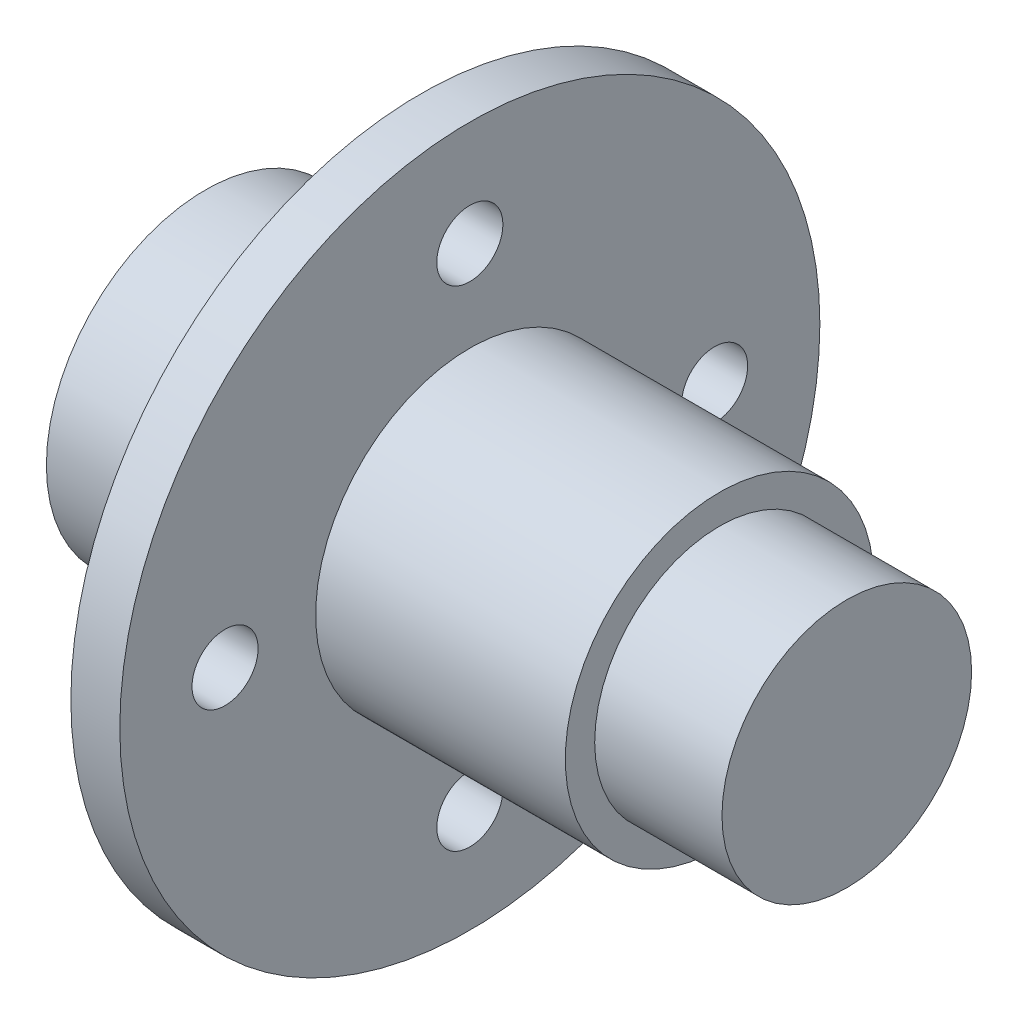
from build123d import *

# Parameters (mm, degrees)
M12_CLEARANCE_HOLE1_D = 13.5
CIRPATTERN1_COUNT     = 4


with BuildPart() as part:
    # Sketch1 → Revolve1 (revolve)
    with BuildSketch(Plane.XY, mode=Mode.PRIVATE) as revolve1_sk:
        Polygon((-32.477216022, 0), (-32.477216022, 32.5), (11.522783978, 32.5), (11.522783978, 71.5), (21.522783978, 71.5), (21.522783978, 31.5), (72.522783978, 31.5), (72.522783978, 25.5), (98.522783978, 25.5), (98.522783978, 0), align=None)
    revolve(revolve1_sk.sketch.rotate(Axis((98.522783978, 0, 0), (-1, 0, 0)), 90), axis=Axis((98.522783978, 0, 0), (-1, 0, 0)))

    # M12 Clearance Hole1 (through all)
    with Locations(Plane(origin=(21.522783978, 50, 0), x_dir=(0, 0, 1), z_dir=(1, 0, 0))):
        with Locations((0, 0)):
            m12_clearance_hole1 = Hole(M12_CLEARANCE_HOLE1_D / 2)

    # CirPattern1: M12 Clearance Hole1 ×4 about axis
    cirpattern1_axis = Axis((0, 0, 0), (1, 0, 0))
    for i in range(1, CIRPATTERN1_COUNT):
        add(m12_clearance_hole1.rotate(cirpattern1_axis, i * 360 / CIRPATTERN1_COUNT), mode=Mode.SUBTRACT)


solid = part.part
